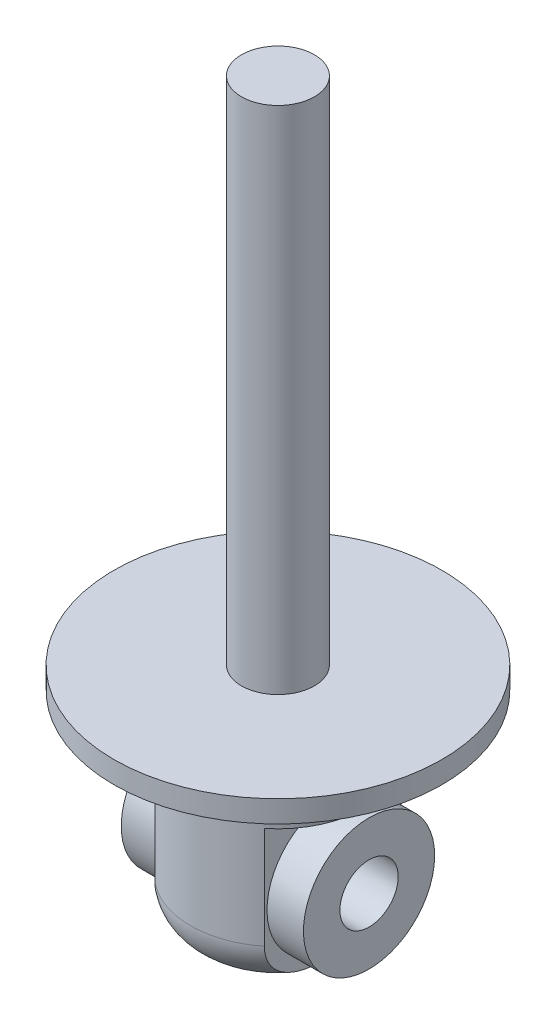
from build123d import *

# Parameters (mm, degrees)
SKETCH1_R               = 22.5
BOSS_EXTRUDE1_DEPTH     = 3
SKETCH2_R               = 5
BOSS_EXTRUDE2_DEPTH     = 70
SKETCH3_R               = 12
BOSS_EXTRUDE3_DEPTH     = 28
FILLET1_R               = 6
CUT_EXTRUDE1_DEPTH      = 28
CUT_EXTRUDE1_DEPTH_BACK = 28
SKETCH4_W               = 20
SKETCH4_H               = 20
SKETCH5_R               = 4
CUT_EXTRUDE2_DEPTH      = 83.068568892
SKETCH6_R               = 9
SKETCH6_R_2             = 4
BOSS_EXTRUDE4_DEPTH     = 12.5


with BuildPart() as part:
    # Sketch1 → Boss-Extrude1 (new body)
    with BuildSketch(Plane(origin=(0, 0, 0), x_dir=(1, 0, 0), z_dir=(0, 1, 0))):
        Circle(SKETCH1_R)
    extrude(amount=BOSS_EXTRUDE1_DEPTH)

    # Sketch2 → Boss-Extrude2 (add)
    with BuildSketch(Plane(origin=(0, 3, 0), x_dir=(1, 0, 0), z_dir=(0, 1, 0))):
        Circle(SKETCH2_R)
    extrude(amount=BOSS_EXTRUDE2_DEPTH)

    # Sketch3 → Boss-Extrude3 (add)
    with BuildSketch(Plane.XZ):
        Circle(SKETCH3_R)
    extrude(amount=BOSS_EXTRUDE3_DEPTH)

    # Fillet1
    fillet1_edges = [part.edges().sort_by_distance(p)[0] for p in [
        (-12, -28, 0),
    ]]
    fillet(fillet1_edges, radius=FILLET1_R)

    # Sketch4 → Cut-Extrude1 (cut, two sides: drawn at the far end of the back side and taken through both)
    with BuildSketch(Plane.XY.offset(-CUT_EXTRUDE1_DEPTH_BACK)):
        with Locations((17.5, -18)):
            Rectangle(SKETCH4_W, SKETCH4_H)
        with Locations((-17.5, -18)):
            Rectangle(SKETCH4_W, SKETCH4_H)
    extrude(amount=CUT_EXTRUDE1_DEPTH + CUT_EXTRUDE1_DEPTH_BACK, mode=Mode.SUBTRACT)

    # Sketch5 → Cut-Extrude2 (cut, through all)
    with BuildSketch(Plane(origin=(7.5, 0, 0), x_dir=(0, 0, -1), z_dir=(1, 0, 0))):
        with Locations((0, -17.904737612)):
            Circle(SKETCH5_R)
    extrude(amount=-CUT_EXTRUDE2_DEPTH, mode=Mode.SUBTRACT)

    # Sketch6 → Boss-Extrude4 (add, symmetric)
    with BuildSketch(Plane(origin=(0, 0, 0), x_dir=(0, 0, -1), z_dir=(1, 0, 0))):
        with Locations((0, -17.904737612)):
            Circle(SKETCH6_R)
        with Locations((0, -17.904737612)):
            Circle(SKETCH6_R_2, mode=Mode.SUBTRACT)
    extrude(amount=BOSS_EXTRUDE4_DEPTH, both=True)


solid = part.part
